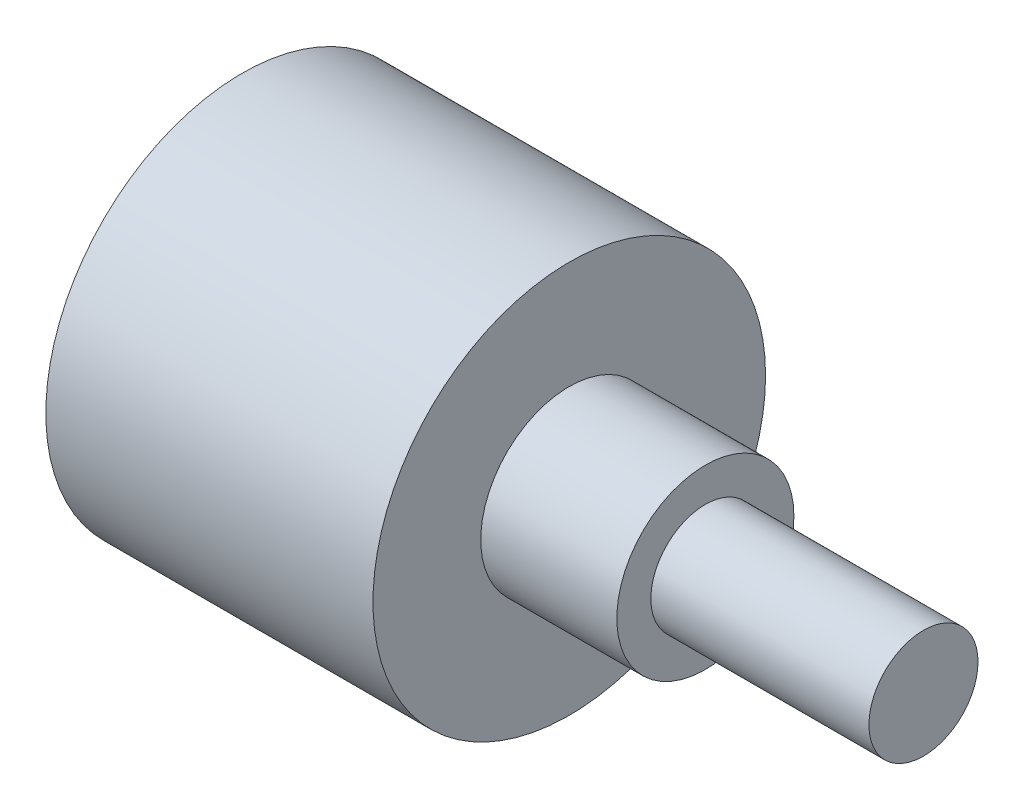
from build123d import *


with BuildPart() as part:
    # Sketch1 → Revolve1 (revolve)
    with BuildSketch(Plane(origin=(0, 0, 0), x_dir=(1, 0, 0), z_dir=(0, 1, 0))):
        Polygon((0, 0), (0, 11.43), (19.05, 11.43), (19.05, 5.1562), (26.9748, 5.1562), (26.9748, 3.175), (39.6748, 3.175), (39.6748, 0), align=None)
    revolve(axis=Axis((0, 0, 0), (-1, 0, 0)))


solid = part.part
